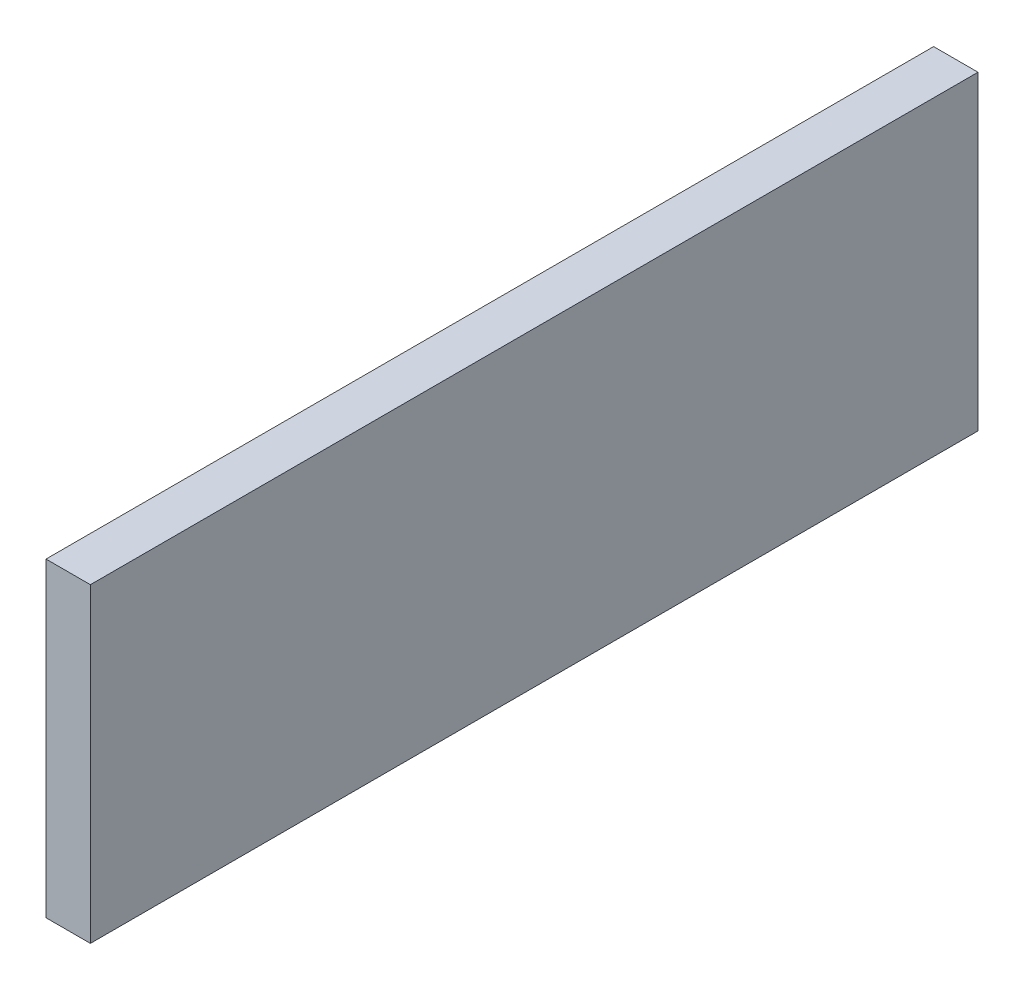
from build123d import *

# Parameters (mm, degrees)
SKETCH1_W           = 12.7
SKETCH1_H           = 88.9
BOSS_EXTRUDE1_DEPTH = 254


with BuildPart() as part:
    # Sketch1 → Boss-Extrude1 (new body)
    with BuildSketch(Plane.XY.offset(25.4)):
        with Locations((298.45, 53.975)):
            Rectangle(SKETCH1_W, SKETCH1_H)
    extrude(amount=BOSS_EXTRUDE1_DEPTH)


solid = part.part
